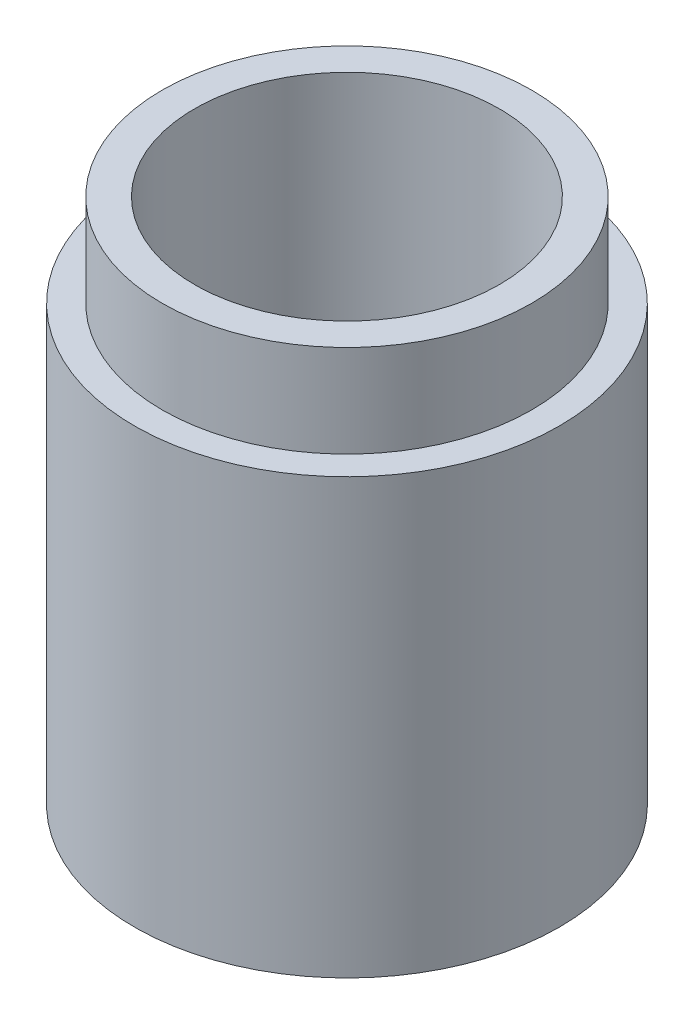
from build123d import *


with BuildPart() as part:
    # Sketch1 → Revolve1 (revolve)
    with BuildSketch(Plane.XY):
        Polygon((1.65, 0), (1.65, 5.7), (2, 5.7), (2, 4.7), (2.3, 4.7), (2.3, 0), align=None)
    revolve(axis=Axis((0, -195.521332278, 0), (0, 1, 0)))


solid = part.part
